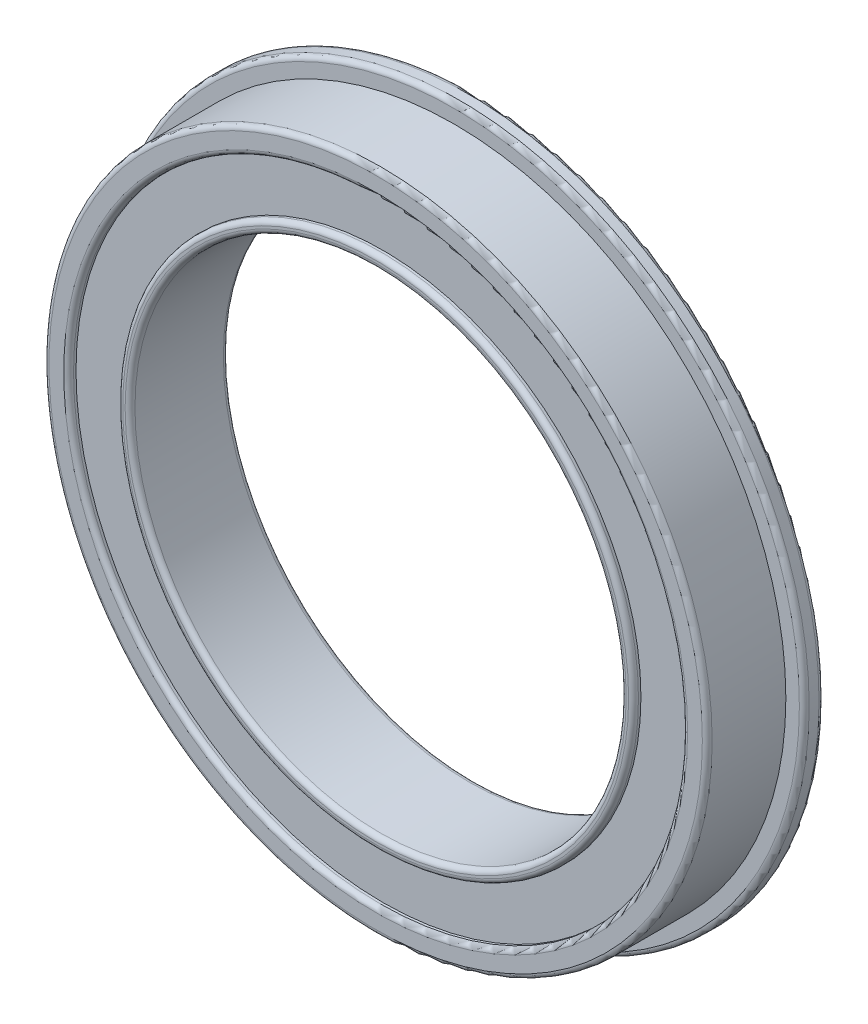
from build123d import *

# Parameters (mm, degrees)
SKETCH1_R          = 14.25
EXTRUDE1_DEPTH     = 0.8
SKETCH2_R          = 13.5
EXTRUDE2_DEPTH     = 3.2
SKETCH3_R          = 10
CUT_EXTRUDE1_DEPTH = 21.545680811
SKETCH4_R          = 12.5
SKETCH4_R_2        = 10.5
CUT_EXTRUDE2_DEPTH = 0.3
CUT_EXTRUDE3_START = -0.3
SKETCH5_R          = 12.5
SKETCH5_R_2        = 10.5
CUT_EXTRUDE3_DEPTH = 0.3
FILLET1_R          = 0.2


with BuildPart() as part:
    # Sketch1 → Extrude1 (new body)
    with BuildSketch(Plane.XY):
        Circle(SKETCH1_R)
    extrude(amount=EXTRUDE1_DEPTH)

    # Sketch2 → Extrude2 (add)
    with BuildSketch(Plane.XY.offset(0.8)):
        Circle(SKETCH2_R)
    extrude(amount=EXTRUDE2_DEPTH)

    # Sketch3 → Cut-Extrude1 (cut, through all)
    with BuildSketch(Plane.XY.offset(4)):
        Circle(SKETCH3_R)
    extrude(amount=-CUT_EXTRUDE1_DEPTH, mode=Mode.SUBTRACT)

    # Sketch4 → Cut-Extrude2 (cut)
    with BuildSketch(Plane.XY.offset(4)):
        Circle(SKETCH4_R)
        Circle(SKETCH4_R_2, mode=Mode.SUBTRACT)
    extrude(amount=-CUT_EXTRUDE2_DEPTH, mode=Mode.SUBTRACT)

    # Sketch5 → Cut-Extrude3 (cut)
    with BuildSketch(Plane(origin=(0, 0, 0), x_dir=(-1, 0, 0), z_dir=(0, 0, -1)).offset(CUT_EXTRUDE3_START)):
        with Locations(Location((0, 0, 0), (0, 0, 180))):
            Circle(SKETCH5_R)
        with Locations(Location((0, 0, 0), (0, 0, 180))):
            Circle(SKETCH5_R_2, mode=Mode.SUBTRACT)
    extrude(amount=CUT_EXTRUDE3_DEPTH, mode=Mode.SUBTRACT)

    # Fillet1
    fillet1_edges = [part.edges().sort_by_distance(p)[0] for p in [
        (-10, 0, 0),
        (-10, 0, 4),
        (-12.5, 0, 4),
        (-10.5, 0, 4),
        (-14.25, 0, 0),
        (-12.5, 0, 0),
        (-10.5, 0, 0),
        (-14.25, 0, 0.8),
        (-13.5, 0, 4),
    ]]
    fillet(fillet1_edges, radius=FILLET1_R)


solid = part.part
